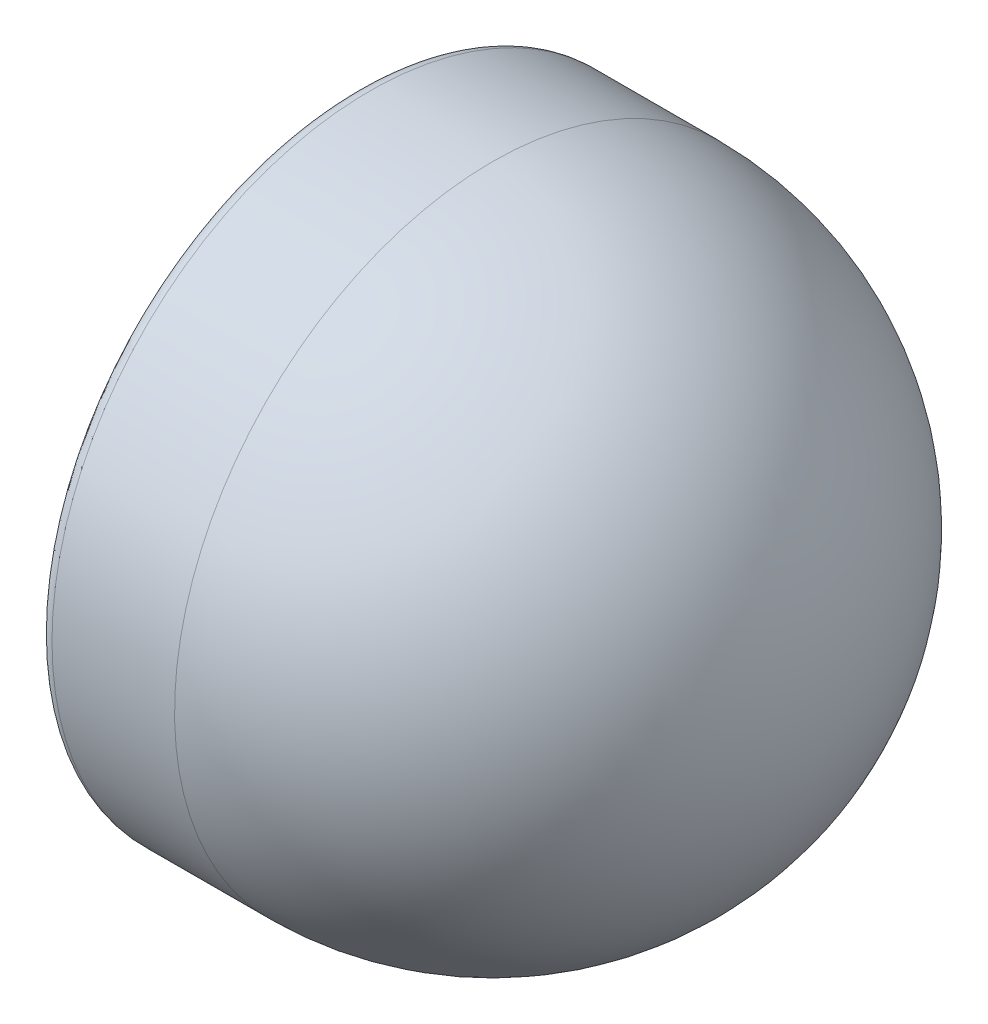
from build123d import *


with BuildPart() as part:
    # Sketch1 → Revolve6 (revolve)
    with BuildSketch(Plane.XY, mode=Mode.PRIVATE) as revolve6_sk:
        with BuildLine():
            Line((-70, 70), (-97, 70))
            ThreePointArc((-97, 70), (-99.121320344, 69.121320344), (-100, 67))
            Line((-100, 67), (-100, 61.5))
            ThreePointArc((-100, 61.5), (-99.560660172, 60.439339828), (-98.5, 60))
            Line((-98.5, 60), (-96.621320344, 60))
            ThreePointArc((-96.621320344, 60), (-96.047295195, 60.114180701), (-95.560660172, 60.439339828))
            Line((-95.560660172, 60.439339828), (-92, 64))
            Line((-92, 64), (-92, 64.707106781))
            Line((-92, 64.707106781), (-92.707106781, 64.707106781))
            Line((-92.707106781, 64.707106781), (-96.267766953, 61.146446609))
            ThreePointArc((-96.267766953, 61.146446609), (-96.429978627, 61.038060234), (-96.621320344, 61))
            Line((-96.621320344, 61), (-98.5, 61))
            ThreePointArc((-98.5, 61), (-98.853553391, 61.146446609), (-99, 61.5))
            Line((-99, 61.5), (-99, 67))
            ThreePointArc((-99, 67), (-98.414213562, 68.414213562), (-97, 69))
            Line((-97, 69), (-70, 69))
            ThreePointArc((-70, 69), (-21.209632098, 48.790367902), (-1, 0))
            Line((-1, 0), (0, 0))
            ThreePointArc((0, 0), (-20.502525317, 49.497474683), (-70, 70))
        make_face()
    revolve(revolve6_sk.sketch.rotate(Axis((0, 0, 0), (-1, 0, 0)), 90), axis=Axis((0, 0, 0), (-1, 0, 0)))


solid = part.part
